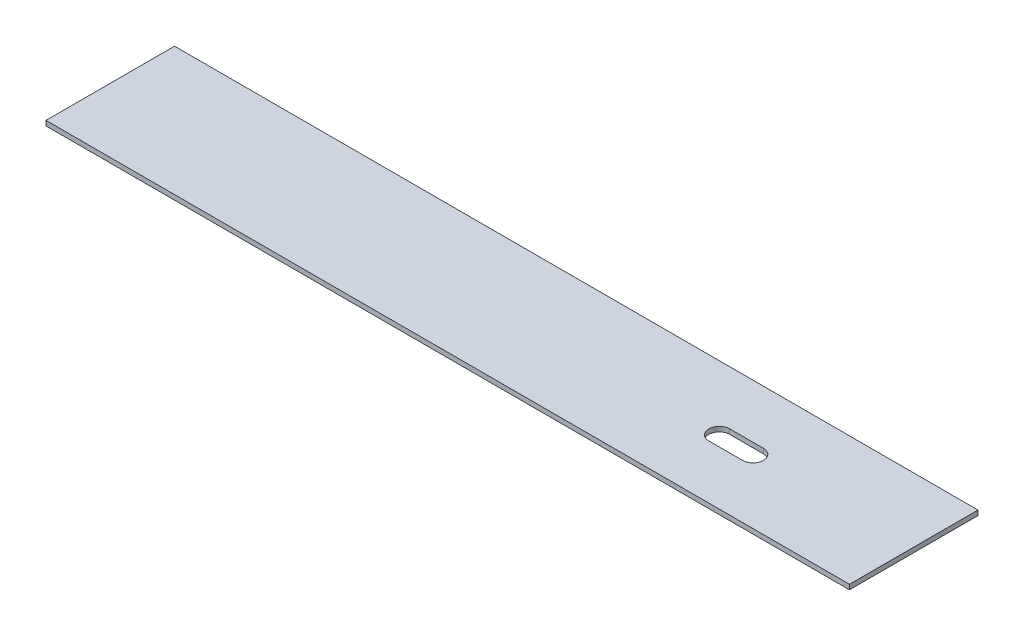
from build123d import *

# Parameters (mm, degrees)
SKETCH_1_W          = 500
SKETCH_1_H          = 80
EXTRUDE_1_DEPTH     = 3
CUT_EXTRUDE_1_DEPTH = 10


with BuildPart() as part:
    # 草图1 → 凸台-拉伸1 (new body)
    with BuildSketch(Plane(origin=(0, 0, 0), x_dir=(1, 0, 0), z_dir=(0, 1, 0))):
        Rectangle(SKETCH_1_W, SKETCH_1_H)
    extrude(amount=EXTRUDE_1_DEPTH)

    # 草图2 → 切除-拉伸1 (cut)
    with BuildSketch(Plane(origin=(0, 3, 0), x_dir=(1, 0, 0), z_dir=(0, 1, 0))):
        with BuildLine():
            Line((129, 6.5), (150, 6.5))
            ThreePointArc((150, 6.5), (156.5, 0), (150, -6.5))
            Line((150, -6.5), (129, -6.5))
            ThreePointArc((129, -6.5), (122.5, 0), (129, 6.5))
        make_face()
    extrude(amount=-CUT_EXTRUDE_1_DEPTH, mode=Mode.SUBTRACT)


solid = part.part
